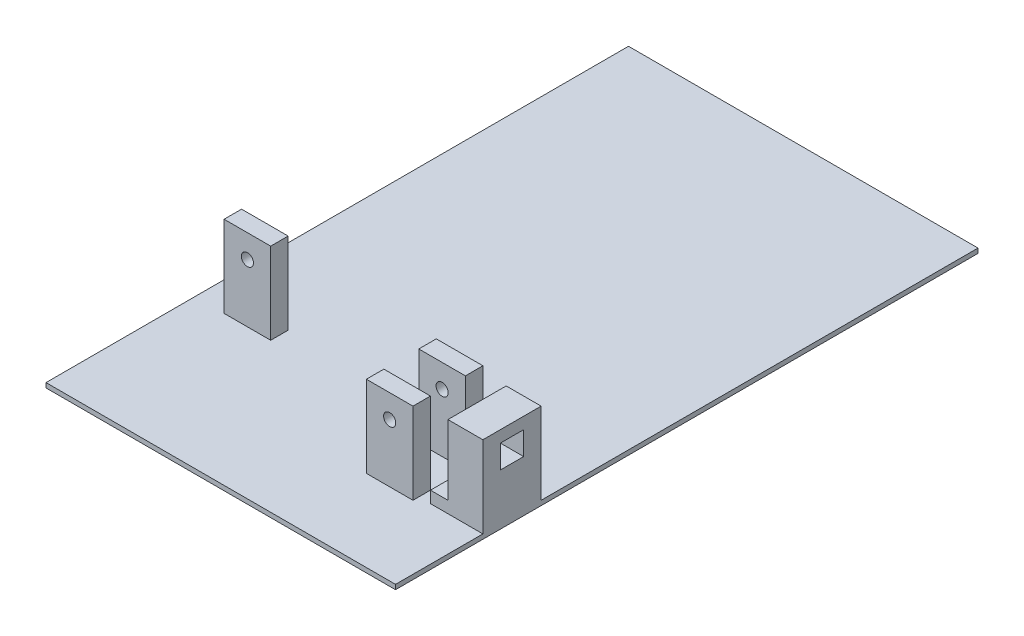
from build123d import *

# Parameters (mm, degrees)
SKETCH1_W           = 150
SKETCH1_H           = 100
SKETCH1_H_2         = 400
SKETCH1_W_2         = 15
SKETCH1_H_3         = 25
SKETCH1_W_3         = 30
BOSS_EXTRUDE1_DEPTH = 4
BOSS_EXTRUDE2_START = 4
SKETCH1_4_W         = 15
SKETCH1_4_H         = 25
SKETCH1_4_W_2       = 30
BOSS_EXTRUDE2_DEPTH = 10
BOSS_EXTRUDE3_START = 14
SKETCH1_5_W         = 30
SKETCH1_5_H         = 50
BOSS_EXTRUDE3_DEPTH = 60
BOSS_EXTRUDE4_START = 4
SKETCH15_W          = 40
SKETCH15_H          = 15
BOSS_EXTRUDE4_DEPTH = 70
SKETCH16_R          = 5.2
CUT_EXTRUDE1_DEPTH  = 588.772064665
CUT_EXTRUDE2_START  = 300
SKETCH17_W          = 20
SKETCH17_H          = 20
CUT_EXTRUDE2_DEPTH  = 26
CUT_EXTRUDE3_START  = 270
CUT_EXTRUDE3_DEPTH  = 318.772064665


with BuildPart() as part:
    # Sketch1 → Boss-Extrude1 (new body)
    with BuildSketch(Plane(origin=(0, 0, 0), x_dir=(1, 0, 0), z_dir=(0, 1, 0))):
        with Locations((75, 50)):
            Rectangle(SKETCH1_W, SKETCH1_H)
        with Locations((75, 300)):
            Rectangle(SKETCH1_W, SKETCH1_H_2)
        Polygon((300, 500), (150, 500), (150, 100), (255, 100), (255, 125), (270, 125), (300, 125), align=None)
        with Locations((262.5, 112.5)):
            Rectangle(SKETCH1_W_2, SKETCH1_H_3)
        with Locations((285, 112.5)):
            Rectangle(SKETCH1_W_3, SKETCH1_H_3)
        Polygon((255, 100), (150, 100), (150, 0), (300, 0), (300, 75), (270, 75), (255, 75), align=None)
        with Locations((262.5, 87.5)):
            Rectangle(SKETCH1_W_2, SKETCH1_H_3)
        with Locations((285, 87.5)):
            Rectangle(SKETCH1_W_3, SKETCH1_H_3)
    extrude(amount=BOSS_EXTRUDE1_DEPTH)

    # Sketch1<4> → Boss-Extrude2 (add)
    with BuildSketch(Plane(origin=(0, 0, 0), x_dir=(1, 0, 0), z_dir=(0, 1, 0)).offset(BOSS_EXTRUDE2_START)):
        with Locations((262.5, 112.5)):
            Rectangle(SKETCH1_4_W, SKETCH1_4_H)
        with Locations((262.5, 87.5)):
            Rectangle(SKETCH1_4_W, SKETCH1_4_H)
        with Locations((285, 87.5)):
            Rectangle(SKETCH1_4_W_2, SKETCH1_4_H)
        with Locations((285, 112.5)):
            Rectangle(SKETCH1_4_W_2, SKETCH1_4_H)
    extrude(amount=BOSS_EXTRUDE2_DEPTH)

    # Sketch1<5> → Boss-Extrude3 (add)
    with BuildSketch(Plane(origin=(0, 0, 0), x_dir=(1, 0, 0), z_dir=(0, 1, 0)).offset(BOSS_EXTRUDE3_START)):
        with Locations((285, 100)):
            Rectangle(SKETCH1_5_W, SKETCH1_5_H)
    extrude(amount=BOSS_EXTRUDE3_DEPTH)

    # Sketch15 → Boss-Extrude4 (add)
    with BuildSketch(Plane(origin=(0, 0, 0), x_dir=(1, 0, 0), z_dir=(0, 1, 0)).offset(BOSS_EXTRUDE4_START)):
        with Locations((225, 122.5)):
            Rectangle(SKETCH15_W, SKETCH15_H)
        with Locations((225, 77.5)):
            Rectangle(SKETCH15_W, SKETCH15_H)
        with Locations((45, 135.366666062)):
            Rectangle(SKETCH15_W, SKETCH15_H)
    extrude(amount=BOSS_EXTRUDE4_DEPTH)

    # Sketch16 → Cut-Extrude1 (cut, through all)
    with BuildSketch(Plane.XY):
        with Locations((225, 54)):
            Circle(SKETCH16_R)
        with Locations((45, 54)):
            Circle(SKETCH16_R)
    extrude(amount=-CUT_EXTRUDE1_DEPTH, mode=Mode.SUBTRACT)

    # Sketch17 → Cut-Extrude2 (cut)
    with BuildSketch(Plane(origin=(0, 0, 0), x_dir=(0, 0, -1), z_dir=(1, 0, 0)).offset(CUT_EXTRUDE2_START)):
        with Locations((100, 54)):
            Rectangle(SKETCH17_W, SKETCH17_H)
    extrude(amount=-CUT_EXTRUDE2_DEPTH, mode=Mode.SUBTRACT)

    # Sketch17<3> → Cut-Extrude3 (cut, through all)
    with BuildSketch(Plane(origin=(0, 0, 0), x_dir=(0, 0, -1), z_dir=(1, 0, 0)).offset(CUT_EXTRUDE3_START)):
        with BuildLine():
            ThreePointArc((103.25, 54), (102.298097039, 56.298097039), (100, 57.25))
            Line((100, 57.25), (100, 50.75))
            ThreePointArc((100, 50.75), (102.298097039, 51.701902961), (103.25, 54))
        make_face()
        with BuildLine():
            Line((100, 50.75), (100, 57.25))
            ThreePointArc((100, 57.25), (96.75, 54), (100, 50.75))
        make_face()
    extrude(amount=CUT_EXTRUDE3_DEPTH, mode=Mode.SUBTRACT)


solid = part.part
